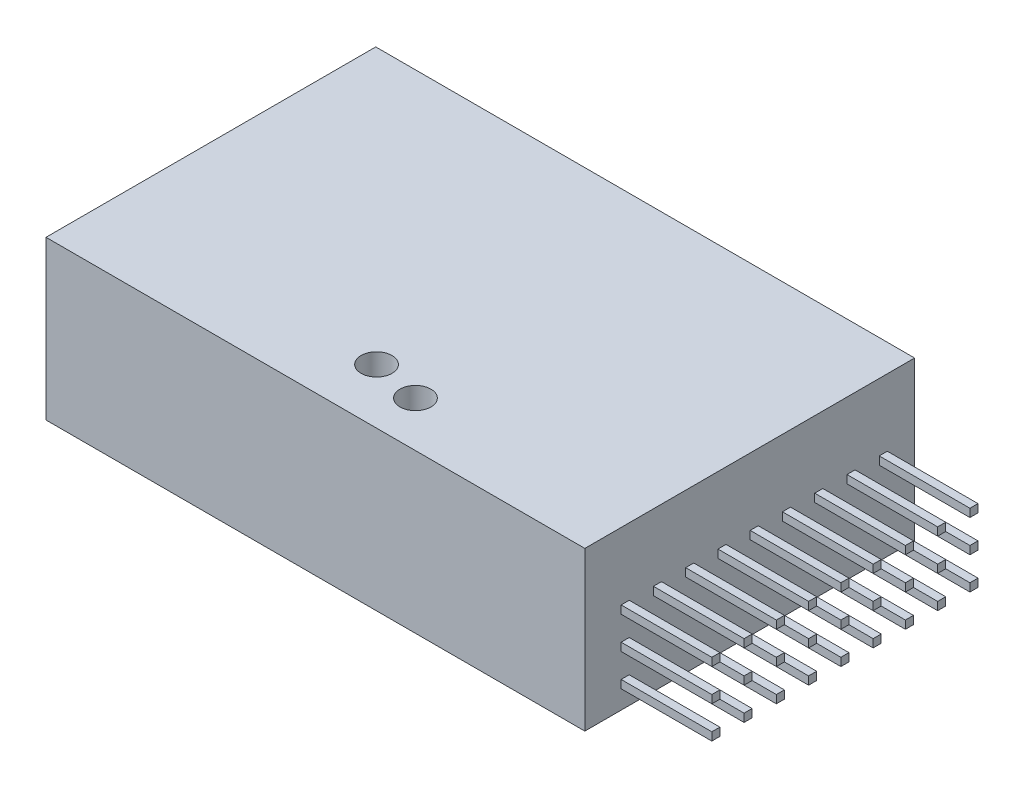
from build123d import *

# Parameters (mm, degrees)
SKETCH1_W          = 42.418
SKETCH1_H          = 25.9588
CASING_DEPTH       = 12.4587
SKETCH2_W          = 0.635
SKETCH2_H          = 0.635
PINS_DEPTH         = 7.1374
PINS_PATTERN_COUNT = 9
PINS_PATTERN_PITCH = 2.54
SKETCH3_R          = 1.2192
LED_DEPTH          = 5.0673
SKETCH4_R          = 1.2192
SCAN_BUTTON_DEPTH  = 3.6195


with BuildPart() as part:
    # Sketch1 → Casing (new body)
    with BuildSketch(Plane(origin=(0, 0, 0), x_dir=(1, 0, 0), z_dir=(0, 1, 0))):
        with Locations((21.209, 12.9794)):
            Rectangle(SKETCH1_W, SKETCH1_H)
    extrude(amount=CASING_DEPTH)

    # Sketch2 → Pins (add)
    with BuildSketch(Plane(origin=(42.418, 0, 0), x_dir=(0, 0, -1), z_dir=(1, 0, 0))):
        with Locations((23.495, 6.858)):
            Rectangle(SKETCH2_W, SKETCH2_H)
        with Locations((23.495, 4.318)):
            Rectangle(SKETCH2_W, SKETCH2_H)
        with Locations((23.495, 1.778)):
            Rectangle(SKETCH2_W, SKETCH2_H)
    pins = extrude(amount=PINS_DEPTH)

    # Pins pattern: Pins ×9
    with Locations(*[(0, 0, i * PINS_PATTERN_PITCH) for i in range(1, PINS_PATTERN_COUNT)]):
        add(pins)

    # Sketch3 → LED (cut)
    with BuildSketch(Plane(origin=(0, 12.4587, 0), x_dir=(1, 0, 0), z_dir=(0, 1, 0))):
        with Locations(Location((25.5016, 3.5814, 0), (0, 0, 270))):
            Circle(SKETCH3_R)
    extrude(amount=-LED_DEPTH, mode=Mode.SUBTRACT)

    # Sketch4 → Scan button (cut)
    with BuildSketch(Plane(origin=(0, 12.4587, 0), x_dir=(1, 0, 0), z_dir=(0, 1, 0))):
        with Locations(Location((21.6789, 4.3434, 0), (0, 0, 270))):
            Circle(SKETCH4_R)
    extrude(amount=-SCAN_BUTTON_DEPTH, mode=Mode.SUBTRACT)


solid = part.part
